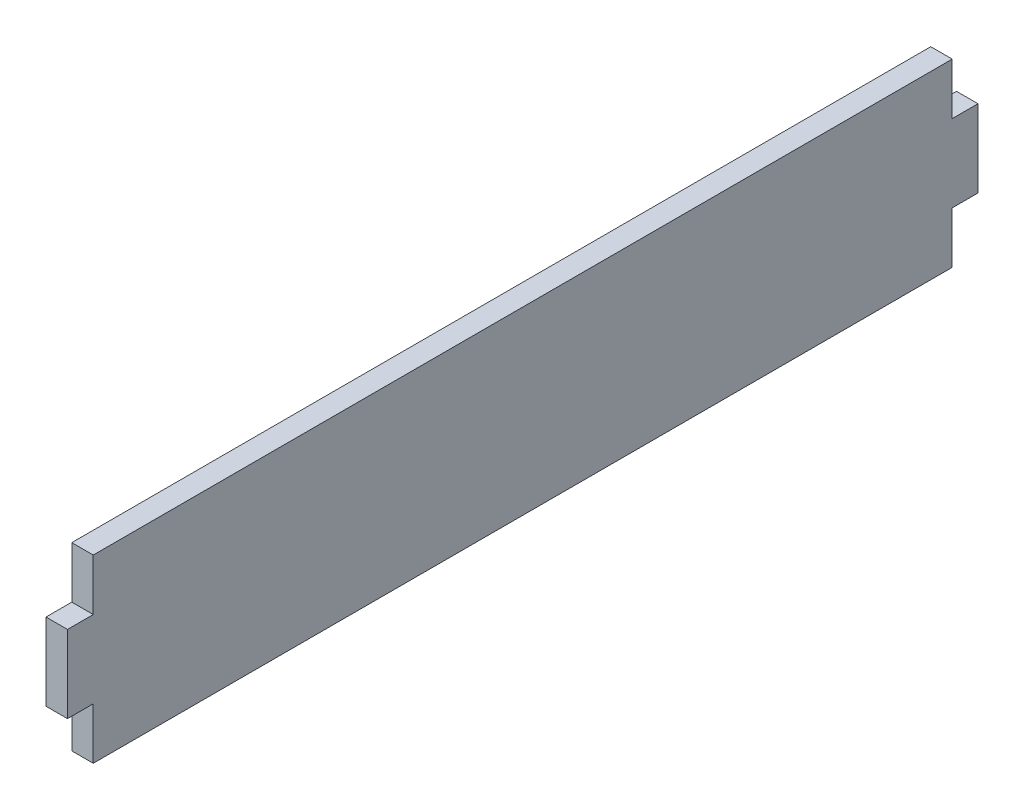
from build123d import *

# Parameters (mm, degrees)
SKETCH1_W           = 2.5
SKETCH1_H           = 21
BOSS_EXTRUDE1_DEPTH = 100
SKETCH1_3_W         = 2.5
SKETCH1_3_H         = 9
BOSS_EXTRUDE2_DEPTH = 3


with BuildPart() as part:
    # Sketch1 → Boss-Extrude1 (new body)
    with BuildSketch(Plane.XY):
        Rectangle(SKETCH1_W, SKETCH1_H)
    extrude(amount=BOSS_EXTRUDE1_DEPTH)

    # Sketch1<3> → Boss-Extrude2 (add)
    with BuildSketch(Plane.XY):
        Rectangle(SKETCH1_3_W, SKETCH1_3_H)
    boss_extrude2 = extrude(amount=-BOSS_EXTRUDE2_DEPTH)

    # Mirror1: Boss-Extrude2 across plane
    add(boss_extrude2.mirror(Plane(origin=(0, 0, 50), x_dir=(1, 0, 0), z_dir=(0, 0, -1))))


solid = part.part
